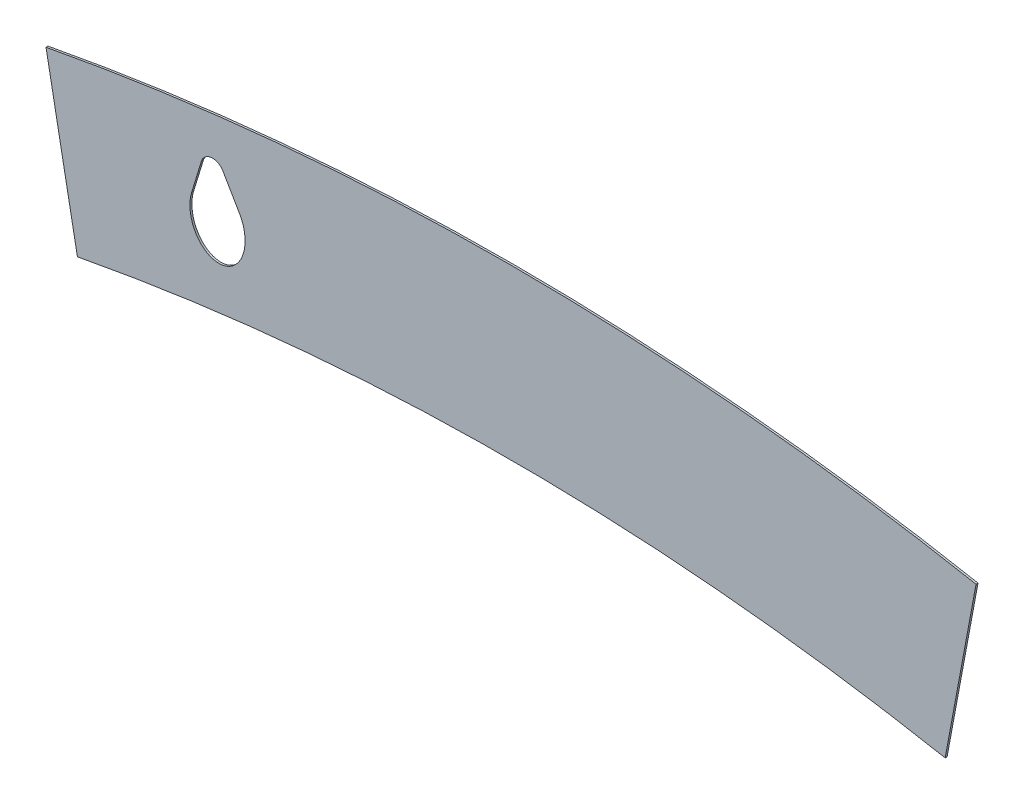
from build123d import *

# Parameters (mm, degrees)
BASE_EXTRUDE_DEPTH = 3.175


with BuildPart() as part:
    # Sketch1 → Base-Extrude (new body)
    with BuildSketch(Plane.XY):
        with BuildLine():
            Line((-752.475, -70.85475791), (-701.6242, -339.127966514))
            ThreePointArc((-701.6242, -339.127966514), (0.43953811, -273.050025704), (702.4878, -339.292192091))
            Line((702.4878, -339.292192091), (752.475, -70.85475791))
            ThreePointArc((752.475, -70.85475791), (0, 0), (-752.475, -70.85475791))
        make_face()
        with BuildLine():
            Line((-501.033720833, -104.998443764), (-516.777000766, -156.384056801))
            add(Edge.make_bspline(
                [(-516.777000766, -156.384056801), (-543.069216838, -242.201094082), (-468.587308293, -233.583243234), (-394.105399749, -224.965392385), (-439.29934176, -147.419585798)],
                knots=[1.070267673, 1.070267673, 1.070267673, 3.141592654, 3.141592654, 5.212917634, 5.212917634, 5.212917634], degree=2, weights=[1, 0.50995617, 1, 0.50995617, 1]))
            Line((-439.29934176, -147.419585798), (-466.360616413, -100.986628705))
            ThreePointArc((-466.360616413, -100.986628705), (-485.00895367, -91.655109348), (-501.033720833, -104.998443764))
        make_face(mode=Mode.SUBTRACT)
    extrude(amount=-BASE_EXTRUDE_DEPTH)


solid = part.part
